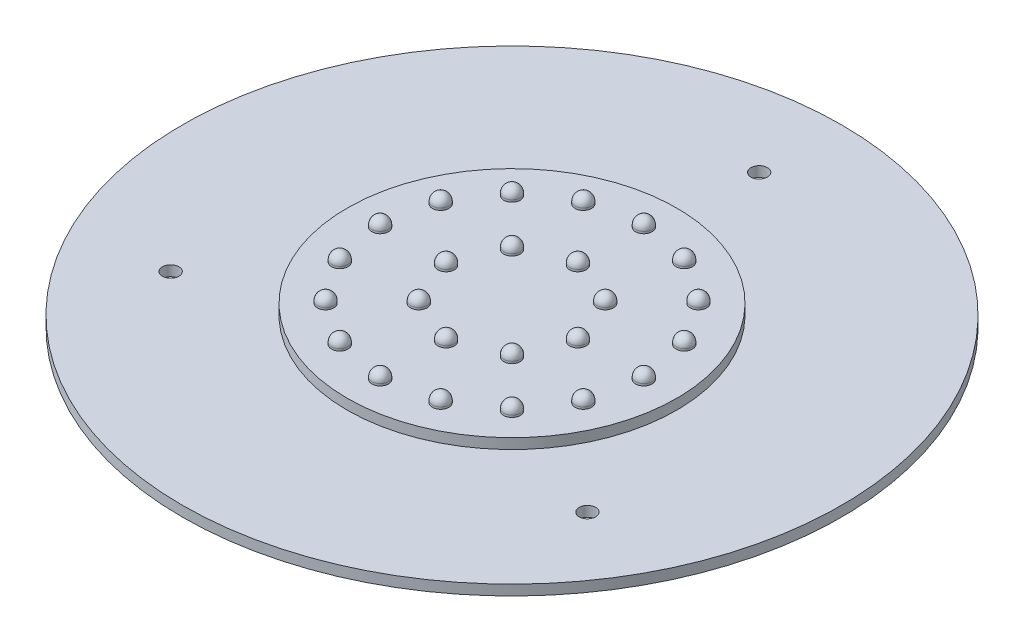
from build123d import *

# Parameters (mm, degrees)
SKETCH_1_R      = 80
EXTRUDE_1_DEPTH = 5
SKETCH_2_R      = 160
EXTRUDE_2_DEPTH = 5
MM_1_D          = 8
MM_1_DEPTH      = 10
MM_1_TIP        = 2.403442476
SKETCH_6_R      = 4
EXTRUDE_3_DEPTH = 5
FILLET_1_R      = 4
SKETCH_8_R      = 4
EXTRUDE_4_DEPTH = 5
FILLET_2_R      = 4


with BuildPart() as part:
    # 草图1 → 凸台-拉伸1 (new body)
    with BuildSketch(Plane(origin=(0, 0, 0), x_dir=(1, 0, 0), z_dir=(0, 1, 0))):
        with Locations(Location((0, 0, 0), (0, 0, 270))):
            Circle(SKETCH_1_R)
    extrude(amount=EXTRUDE_1_DEPTH)

    # 草图2 → 凸台-拉伸2 (add)
    with BuildSketch(Plane(origin=(0, 0, 0), x_dir=(1, 0, 0), z_dir=(0, 1, 0))):
        with Locations(Location((0, 0, 0), (0, 0, 270))):
            Circle(SKETCH_2_R)
    extrude(amount=-EXTRUDE_2_DEPTH)

    # 大小mm 暗销孔1
    with Locations(Plane(origin=(0, 0, -120), x_dir=(0, 0, 1), z_dir=(0, 1, 0))):
        with Locations((0, 0), (184.550425689, -101.159490624), (184.550425689, 101.159490624)):
            Hole(MM_1_D / 2, depth=MM_1_DEPTH)
            with Locations((0, 0, -(MM_1_DEPTH + MM_1_TIP / 2))):  # 118° drill point
                Cone(0, MM_1_D / 2, MM_1_TIP, mode=Mode.SUBTRACT)

    # 草图6 → 凸台-拉伸3 (add)
    with BuildSketch(Plane(origin=(0, 5, 0), x_dir=(1, 0, 0), z_dir=(0, 1, 0))):
        with Locations(Location((0, 64, 0), (0, 0, 270))):
            Circle(SKETCH_6_R)
        with Locations(Location((24.491739671, 59.128290081, 0), (0, 0, 270))):
            Circle(SKETCH_6_R)
        with Locations(Location((45.254833996, 45.254833996, 0), (0, 0, 270))):
            Circle(SKETCH_6_R)
        with Locations(Location((59.128290081, 24.491739671, 0), (0, 0, 270))):
            Circle(SKETCH_6_R)
        with Locations(Location((64, 0, 0), (0, 0, 270))):
            Circle(SKETCH_6_R)
        with Locations(Location((59.128290081, -24.491739671, 0), (0, 0, 270))):
            Circle(SKETCH_6_R)
        with Locations(Location((45.254833996, -45.254833996, 0), (0, 0, 270))):
            Circle(SKETCH_6_R)
        with Locations(Location((24.491739671, -59.128290081, 0), (0, 0, 270))):
            Circle(SKETCH_6_R)
        with Locations(Location((0, -64, 0), (0, 0, 270))):
            Circle(SKETCH_6_R)
        with Locations(Location((-24.491739671, -59.128290081, 0), (0, 0, 270))):
            Circle(SKETCH_6_R)
        with Locations(Location((-45.254833996, -45.254833996, 0), (0, 0, 270))):
            Circle(SKETCH_6_R)
        with Locations(Location((-59.128290081, -24.491739671, 0), (0, 0, 270))):
            Circle(SKETCH_6_R)
        with Locations(Location((-64, 0, 0), (0, 0, 270))):
            Circle(SKETCH_6_R)
        with Locations(Location((-59.128290081, 24.491739671, 0), (0, 0, 270))):
            Circle(SKETCH_6_R)
        with Locations(Location((-45.254833996, 45.254833996, 0), (0, 0, 270))):
            Circle(SKETCH_6_R)
        with Locations(Location((-24.491739671, 59.128290081, 0), (0, 0, 270))):
            Circle(SKETCH_6_R)
    extrude(amount=EXTRUDE_3_DEPTH)

    # 圆角1
    fillet_1_edges = [part.edges().sort_by_distance(p)[0] for p in [
        (0, 10, -68),
        (24.491739671, 10, -63.128290081),
        (45.254833996, 10, -49.254833996),
        (59.128290081, 10, -28.491739671),
        (64, 10, -4),
        (59.128290081, 10, 20.491739671),
        (45.254833996, 10, 41.254833996),
        (24.491739671, 10, 55.128290081),
        (0, 10, 60),
        (-24.491739671, 10, 55.128290081),
        (-45.254833996, 10, 41.254833996),
        (-59.128290081, 10, 20.491739671),
        (-64, 10, -4),
        (-59.128290081, 10, -28.491739671),
        (-45.254833996, 10, -49.254833996),
        (-24.491739671, 10, -63.128290081),
    ]]
    fillet(fillet_1_edges, radius=FILLET_1_R)

    # 草图8 → 凸台-拉伸4 (add)
    with BuildSketch(Plane(origin=(0, 5, 0), x_dir=(1, 0, 0), z_dir=(0, 1, 0))):
        with Locations(Location((0, 32, 0), (0, 0, 270))):
            Circle(SKETCH_8_R)
        with Locations(Location((22.627416998, 22.627416998, 0), (0, 0, 270))):
            Circle(SKETCH_8_R)
        with Locations(Location((32, 0, 0), (0, 0, 270))):
            Circle(SKETCH_8_R)
        with Locations(Location((22.627416998, -22.627416998, 0), (0, 0, 270))):
            Circle(SKETCH_8_R)
        with Locations(Location((0, -32, 0), (0, 0, 270))):
            Circle(SKETCH_8_R)
        with Locations(Location((-22.627416998, -22.627416998, 0), (0, 0, 270))):
            Circle(SKETCH_8_R)
        with Locations(Location((-32, 0, 0), (0, 0, 270))):
            Circle(SKETCH_8_R)
        with Locations(Location((-22.627416998, 22.627416998, 0), (0, 0, 270))):
            Circle(SKETCH_8_R)
    extrude(amount=EXTRUDE_4_DEPTH)

    # 圆角2
    fillet_2_edges = [part.edges().sort_by_distance(p)[0] for p in [
        (0, 10, -36),
        (22.627416998, 10, -26.627416998),
        (32, 10, -4),
        (22.627416998, 10, 18.627416998),
        (0, 10, 28),
        (-22.627416998, 10, 18.627416998),
        (-32, 10, -4),
        (-22.627416998, 10, -26.627416998),
    ]]
    fillet(fillet_2_edges, radius=FILLET_2_R)


solid = part.part
